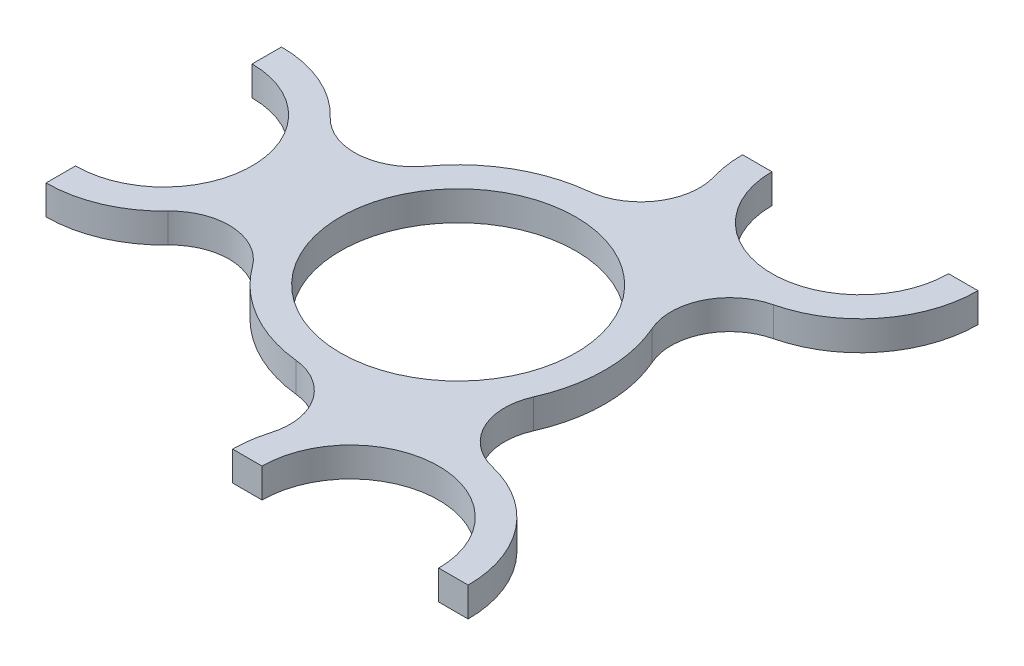
from build123d import *

# Parameters (mm, degrees)
SKETCH1_R           = 40
BOSS_EXTRUDE1_DEPTH = 10


with BuildPart() as part:
    # Sketch1 → Boss-Extrude1 (new body)
    with BuildSketch(Plane(origin=(0, 0, 0), x_dir=(1, 0, 0), z_dir=(0, 1, 0))):
        with BuildLine():
            Line((-100, 40), (-100, 30))
            ThreePointArc((-100, 30), (-70, 0), (-100, -30))
            Line((-100, -30), (-100, -40))
            ThreePointArc((-100, -40), (-84.220237409, -36.755939555), (-71, -27.549954628))
            ThreePointArc((-71, -27.549954628), (-55.218260111, -21.366045629), (-40.357142857, -29.51780853))
            ThreePointArc((-40.357142857, -29.51780853), (-25.000226369, -43.301139494), (-5.38512036, -49.709158902))
            ThreePointArc((-5.38512036, -49.709158902), (9.104684892, -58.503090991), (11.64055433, -75.261881641))
            ThreePointArc((11.64055433, -75.261881641), (10.412263093, -80.871903754), (10, -86.6))
            Line((10, -86.6), (20, -86.6))
            ThreePointArc((20, -86.6), (50, -56.6), (80, -86.6))
            Line((80, -86.6), (90, -86.6))
            ThreePointArc((90, -86.6), (81.419623277, -61.845055583), (59.359636345, -47.710448608))
            ThreePointArc((59.359636345, -47.710448608), (46.113763964, -37.135262428), (45.742467512, -20.189766365))
            ThreePointArc((45.742467512, -20.189766365), (50, 0), (45.742467512, 20.189766365))
            ThreePointArc((45.742467512, 20.189766365), (46.113763964, 37.135262428), (59.359636345, 47.710448608))
            ThreePointArc((59.359636345, 47.710448608), (81.419623277, 61.845055583), (90, 86.6))
            Line((90, 86.6), (80, 86.6))
            ThreePointArc((80, 86.6), (50, 56.6), (20, 86.6))
            Line((20, 86.6), (10, 86.6))
            ThreePointArc((10, 86.6), (10.412263093, 80.871903754), (11.64055433, 75.261881641))
            ThreePointArc((11.64055433, 75.261881641), (9.104684892, 58.503090991), (-5.38512036, 49.709158902))
            ThreePointArc((-5.38512036, 49.709158902), (-25.000226369, 43.301139494), (-40.357142857, 29.51780853))
            ThreePointArc((-40.357142857, 29.51780853), (-55.218260111, 21.366045629), (-71, 27.549954628))
            ThreePointArc((-71, 27.549954628), (-84.220237409, 36.755939555), (-100, 40))
        make_face()
        with Locations(Location((0, 0, 0), (0, 0, 270))):
            Circle(SKETCH1_R, mode=Mode.SUBTRACT)
    extrude(amount=BOSS_EXTRUDE1_DEPTH)


solid = part.part
